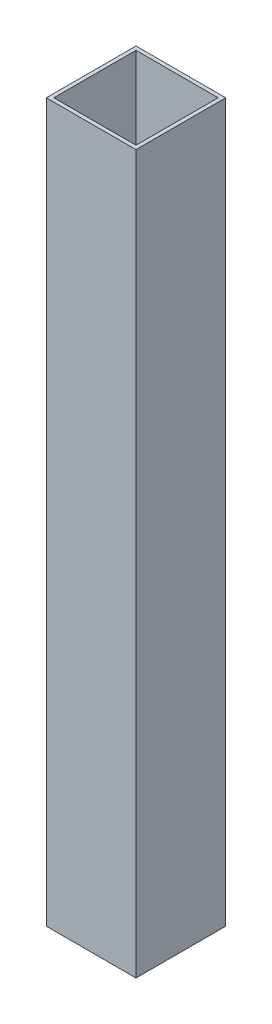
from build123d import *

# Parameters (mm, degrees)
SKETCH1_W           = 38.1
SKETCH1_H           = 38.1
SKETCH1_W_2         = 34.925
SKETCH1_H_2         = 34.925
BOSS_EXTRUDE1_DEPTH = 304.8


with BuildPart() as part:
    # Sketch1 → Boss-Extrude1 (new body)
    with BuildSketch(Plane(origin=(0, 0, 0), x_dir=(1, 0, 0), z_dir=(0, 1, 0))):
        Rectangle(SKETCH1_W, SKETCH1_H)
        Rectangle(SKETCH1_W_2, SKETCH1_H_2, mode=Mode.SUBTRACT)
    extrude(amount=BOSS_EXTRUDE1_DEPTH)


solid = part.part
